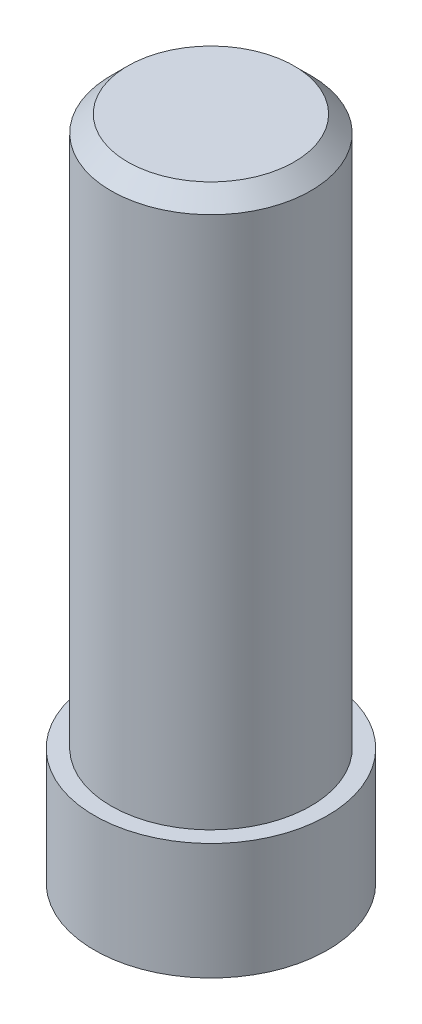
from build123d import *

# Parameters (mm, degrees)
SKETCH1_R           = 6
BOSS_EXTRUDE2_DEPTH = 16.5
SKETCH2_R           = 7
BOSS_EXTRUDE3_DEPTH = 7
CHAMFER1_SIZE       = 1


with BuildPart() as part:
    # Sketch1 → Boss-Extrude2 (new, symmetric)
    with BuildSketch(Plane(origin=(0, 0, 0), x_dir=(1, 0, 0), z_dir=(0, 1, 0))):
        with Locations(Location((0, 0, 0), (0, 0, 270))):
            Circle(SKETCH1_R)
    extrude(amount=BOSS_EXTRUDE2_DEPTH, both=True)

    # Sketch2 → Boss-Extrude3 (add)
    with BuildSketch(Plane.XZ.offset(16.5)):
        with Locations(Location((0, 0, 0), (0, 0, 270))):
            Circle(SKETCH2_R)
    extrude(amount=BOSS_EXTRUDE3_DEPTH)

    # Chamfer1
    chamfer1_edges = [part.edges().sort_by_distance(p)[0] for p in [
        (0, 16.5, -6),
    ]]
    chamfer(chamfer1_edges, length=CHAMFER1_SIZE)


solid = part.part
